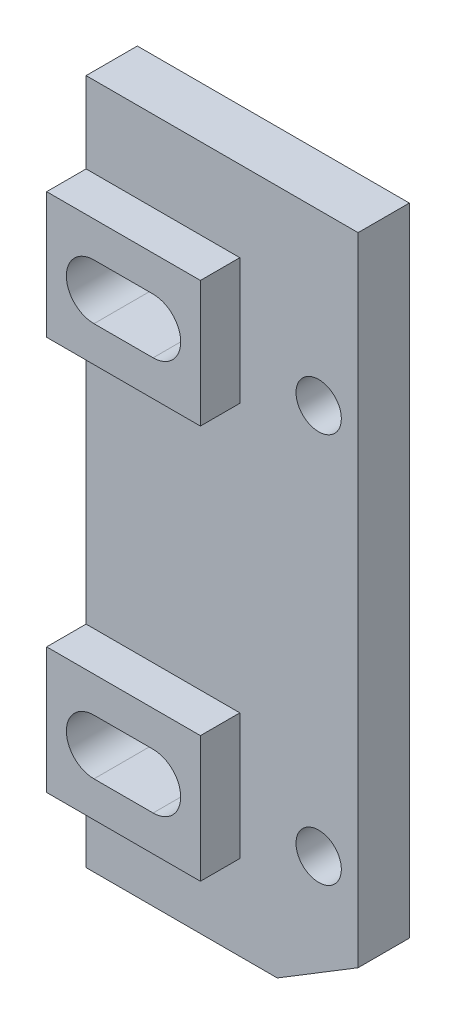
from build123d import *

# Parameters (mm, degrees)
OPPOSITE_END_CROSSBAR_WITH_TWO_ADJUS_2_R       = 1.15
OPPOSITE_END_CROSSBAR_WITH_TWO_ADJUSTABL_DEPTH = 2.6
TWO_START                                      = 2.6
TWO_RAISED_PCB_BOLT_PADS_PROFILE_W             = 7.8
TWO_RAISED_PCB_BOLT_PADS_PROFILE_H             = 6.4
TWO_RAISED_PCB_BOLT_PADS_DEPTH                 = 2


with BuildPart() as part:
    # Opposite end crossbar with two adjus 2 → Opposite end crossbar with two adjustabl (new body)
    with BuildSketch(Plane.XY):
        Polygon((25, -24), (34.7, -24), (38.8, -21.5), (38.8, 10.8), (25, 10.8), align=None)
        with Locations((36.8, -17.6)):
            Circle(OPPOSITE_END_CROSSBAR_WITH_TWO_ADJUS_2_R, mode=Mode.SUBTRACT)
        with Locations((36.8, 2.2)):
            Circle(OPPOSITE_END_CROSSBAR_WITH_TWO_ADJUS_2_R, mode=Mode.SUBTRACT)
        with BuildLine():
            Line((27.4, -17.9), (30.4, -17.9))
            ThreePointArc((30.4, -17.9), (31.8, -16.5), (30.4, -15.1))
            Line((30.4, -15.1), (27.4, -15.1))
            ThreePointArc((27.4, -15.1), (26, -16.5), (27.4, -17.9))
        make_face(mode=Mode.SUBTRACT)
        with BuildLine():
            Line((27.4, 2.1), (30.4, 2.1))
            ThreePointArc((30.4, 2.1), (31.8, 3.5), (30.4, 4.9))
            Line((30.4, 4.9), (27.4, 4.9))
            ThreePointArc((27.4, 4.9), (26, 3.5), (27.4, 2.1))
        make_face(mode=Mode.SUBTRACT)
    extrude(amount=OPPOSITE_END_CROSSBAR_WITH_TWO_ADJUSTABL_DEPTH)

    # Two raised PCB bolt pads profile → Two raised PCB bolt pads (add)
    # profile 1 of 2: a face of its own
    with BuildSketch(Plane.XY.offset(TWO_START)):
        with Locations((28.9, -16.5)):
            Rectangle(TWO_RAISED_PCB_BOLT_PADS_PROFILE_W, TWO_RAISED_PCB_BOLT_PADS_PROFILE_H)
        with BuildLine():
            Line((27.4, -17.9), (30.4, -17.9))
            ThreePointArc((30.4, -17.9), (31.8, -16.5), (30.4, -15.1))
            Line((30.4, -15.1), (27.4, -15.1))
            ThreePointArc((27.4, -15.1), (26, -16.5), (27.4, -17.9))
        make_face(mode=Mode.SUBTRACT)
    # profile 2 of 2: a face of its own
    with BuildSketch(Plane.XY.offset(TWO_START)):
        with Locations((28.9, 3.5)):
            Rectangle(TWO_RAISED_PCB_BOLT_PADS_PROFILE_W, TWO_RAISED_PCB_BOLT_PADS_PROFILE_H)
        with BuildLine():
            Line((27.4, 2.1), (30.4, 2.1))
            ThreePointArc((30.4, 2.1), (31.8, 3.5), (30.4, 4.9))
            Line((30.4, 4.9), (27.4, 4.9))
            ThreePointArc((27.4, 4.9), (26, 3.5), (27.4, 2.1))
        make_face(mode=Mode.SUBTRACT)
    extrude(amount=TWO_RAISED_PCB_BOLT_PADS_DEPTH)


solid = part.part
